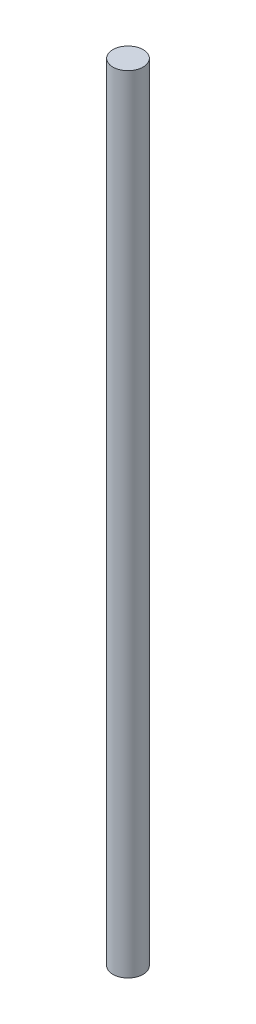
from build123d import *

# Parameters (mm, degrees)
SKETCH_1_R      = 2.5
EXTRUDE_1_DEPTH = 130


with BuildPart() as part:
    # 草图1 → 凸台-拉伸1 (new body)
    with BuildSketch(Plane(origin=(0, 0, 0), x_dir=(1, 0, 0), z_dir=(0, 1, 0))):
        with Locations(Location((0, 0, 0), (0, 0, 270))):
            Circle(SKETCH_1_R)
    extrude(amount=EXTRUDE_1_DEPTH)


solid = part.part
